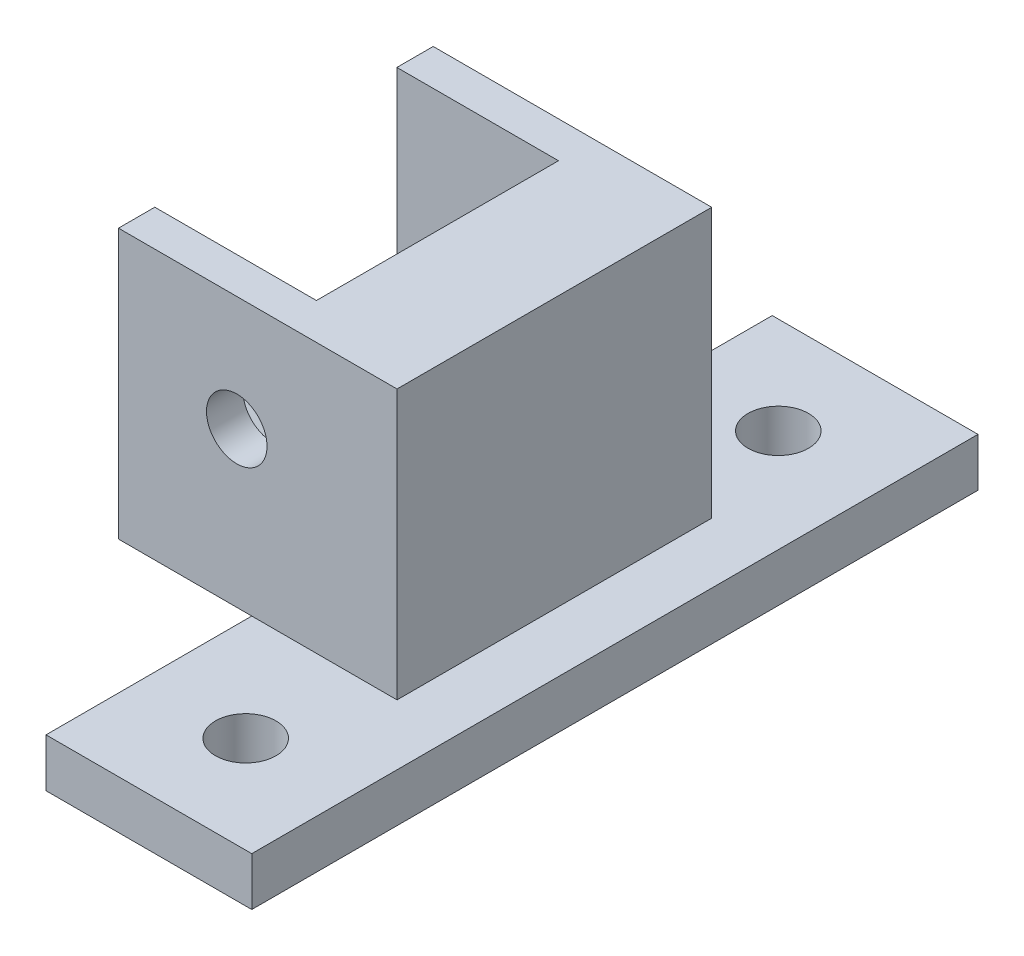
from build123d import *

# Parameters (mm, degrees)
BOSS_EXTRUDE1_DEPTH = 29.21
SKETCH2_R           = 3.175
BOSS_EXTRUDE2_DEPTH = 3.81
BOSS_EXTRUDE4_START = 3.81
SKETCH3_W           = 29.223613814
SKETCH3_H           = 28.25489527
SKETCH3_R           = 3.175
BOSS_EXTRUDE4_DEPTH = 3.81
SKETCH4_W           = 21.59
SKETCH4_H           = 76.2
SKETCH4_R           = 3.175
BOSS_EXTRUDE5_DEPTH = 5.08


with BuildPart() as part:
    # Sketch1 → Boss-Extrude1 (new body)
    with BuildSketch(Plane.XY):
        with BuildLine():
            Line((497.233946268, 332.485515977), (497.233946268, 323.779975182))
            Line((497.233946268, 323.779975182), (526.457560082, 323.779975182))
            Line((526.457560082, 323.779975182), (526.457560082, 352.034870452))
            Line((526.457560082, 352.034870452), (514.19218435, 352.034870452))
            Line((514.19218435, 352.034870452), (515.97416853, 351.010540676))
            ThreePointArc((515.97416853, 351.010540676), (518.254444166, 349.336379834), (520.107560082, 347.198990562))
            ThreePointArc((520.107560082, 347.198990562), (520.655570716, 333.67086151), (508.689794246, 327.335975182))
            ThreePointArc((508.689794246, 327.335975182), (505.910190066, 327.86159111), (503.31589155, 328.989459324))
            Line((503.31589155, 328.989459324), (497.233946268, 332.485515977))
        make_face()
    extrude(amount=-BOSS_EXTRUDE1_DEPTH)

    # Sketch2 → Boss-Extrude2 (add)
    with BuildSketch(Plane(origin=(0, 0, -25.4), x_dir=(-1, 0, 0), z_dir=(0, 0, -1))):
        with BuildLine():
            Line((-514.19218435, 352.034870452), (-497.233946268, 352.034870452))
            Line((-497.233946268, 352.034870452), (-497.233946268, 332.485515977))
            Line((-497.233946268, 332.485515977), (-503.31589155, 328.989459324))
            ThreePointArc((-503.31589155, 328.989459324), (-520.655570716, 333.67086151), (-515.97416853, 351.010540676))
            Line((-515.97416853, 351.010540676), (-514.19218435, 352.034870452))
        make_face()
        with Locations(Location((-509.64503004, 340, 0), (0, 0, 180))):
            Circle(SKETCH2_R, mode=Mode.SUBTRACT)
    extrude(amount=BOSS_EXTRUDE2_DEPTH)

    # Sketch3 → Boss-Extrude4 (add)
    with BuildSketch(Plane.XY.offset(BOSS_EXTRUDE4_START)):
        with Locations((511.845753175, 337.907422817)):
            Rectangle(SKETCH3_W, SKETCH3_H)
        with Locations((509.64503004, 340)):
            Circle(SKETCH3_R, mode=Mode.SUBTRACT)
    extrude(amount=-BOSS_EXTRUDE4_DEPTH)

    # Sketch4 → Boss-Extrude5 (add)
    with BuildSketch(Plane(origin=(0, 323.779975182, 0), x_dir=(1, 0, 0), z_dir=(0, 1, 0))):
        with Locations((522.012560082, 12.7)):
            Rectangle(SKETCH4_W, SKETCH4_H)
        with Locations(Location((522.012560082, 40.64, 0), (0, 0, 270))):
            Circle(SKETCH4_R, mode=Mode.SUBTRACT)
        with Locations(Location((522.012560082, -15.24, 0), (0, 0, 270))):
            Circle(SKETCH4_R, mode=Mode.SUBTRACT)
    extrude(amount=-BOSS_EXTRUDE5_DEPTH)


solid = part.part
